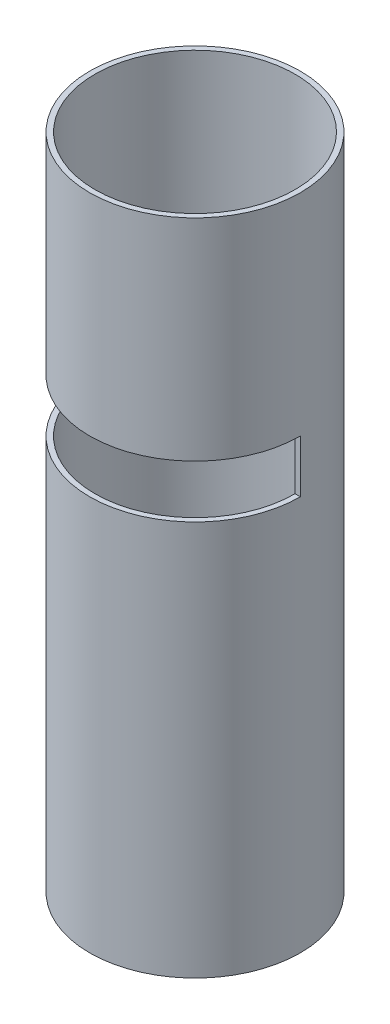
from build123d import *

# Parameters (mm, degrees)
SKETCH1_R           = 40
SKETCH1_R_2         = 38
BOSS_EXTRUDE1_DEPTH = 250
SKETCH2_W           = 80
SKETCH2_H           = 20
CUT_EXTRUDE2_DEPTH  = 257.32011236


with BuildPart() as part:
    # Sketch1 → Boss-Extrude1 (new body)
    with BuildSketch(Plane(origin=(0, 0, 0), x_dir=(1, 0, 0), z_dir=(0, 1, 0))):
        with Locations(Location((0, 0, 0), (0, 0, 270))):
            Circle(SKETCH1_R)
        with Locations(Location((0, 0, 0), (0, 0, 270))):
            Circle(SKETCH1_R_2, mode=Mode.SUBTRACT)
    extrude(amount=BOSS_EXTRUDE1_DEPTH)

    # Sketch2 → Cut-Extrude2 (cut, through all)
    with BuildSketch(Plane.XY):
        with Locations((0, 160)):
            Rectangle(SKETCH2_W, SKETCH2_H)
    extrude(amount=CUT_EXTRUDE2_DEPTH, mode=Mode.SUBTRACT)


solid = part.part
